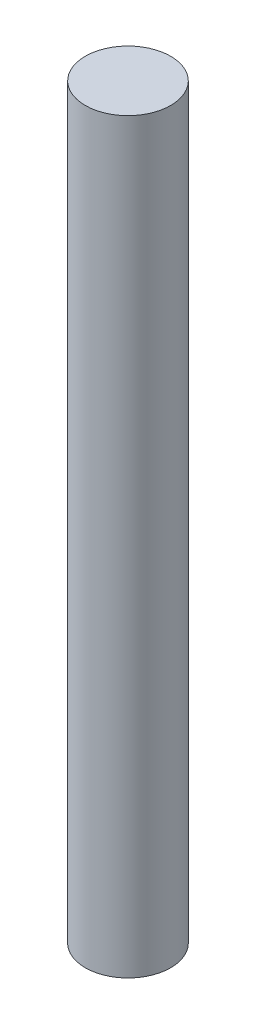
from build123d import *

# Parameters (mm, degrees)
SKETCH1_R           = 4
BOSS_EXTRUDE2_DEPTH = 70


with BuildPart() as part:
    # Sketch1 → Boss-Extrude2 (new body)
    with BuildSketch(Plane(origin=(0, 0, 0), x_dir=(1, 0, 0), z_dir=(0, 1, 0))):
        with Locations(Location((0, 0, 0), (0, 0, 270))):
            Circle(SKETCH1_R)
    extrude(amount=BOSS_EXTRUDE2_DEPTH)


solid = part.part
